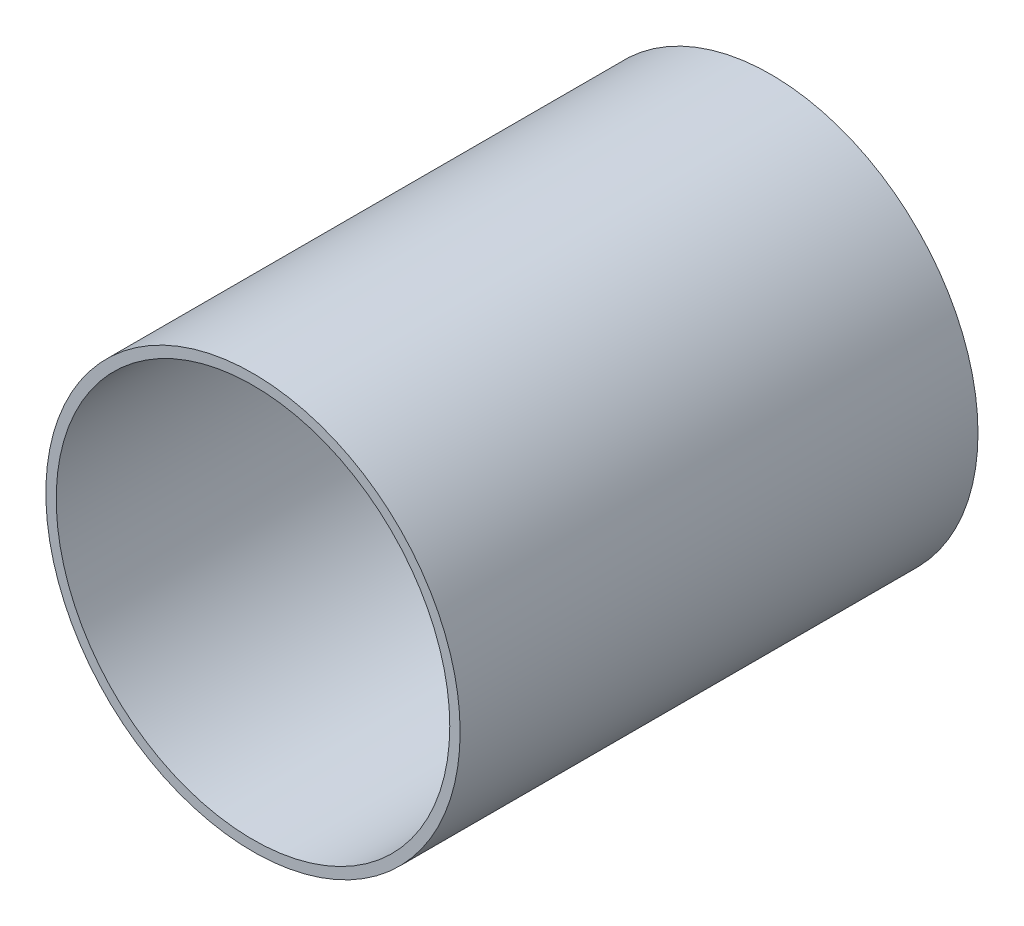
from build123d import *

# Parameters (mm, degrees)
SKETCH1_R           = 40
BOSS_EXTRUDE1_DEPTH = 1
BOSS_EXTRUDE2_START = 98
SKETCH2_R           = 40
SKETCH2_R_2         = 38
BOSS_EXTRUDE2_DEPTH = 98


with BuildPart() as part:
    # Sketch1 → Boss-Extrude1 (new, symmetric)
    with BuildSketch(Plane.XY):
        Circle(SKETCH1_R)
    extrude(amount=BOSS_EXTRUDE1_DEPTH, both=True)

    # Sketch2 → Boss-Extrude2 (add)
    with BuildSketch(Plane.XY.offset(1).offset(BOSS_EXTRUDE2_START)):
        Circle(SKETCH2_R)
        Circle(SKETCH2_R_2, mode=Mode.SUBTRACT)
    extrude(amount=-BOSS_EXTRUDE2_DEPTH)


solid = part.part
